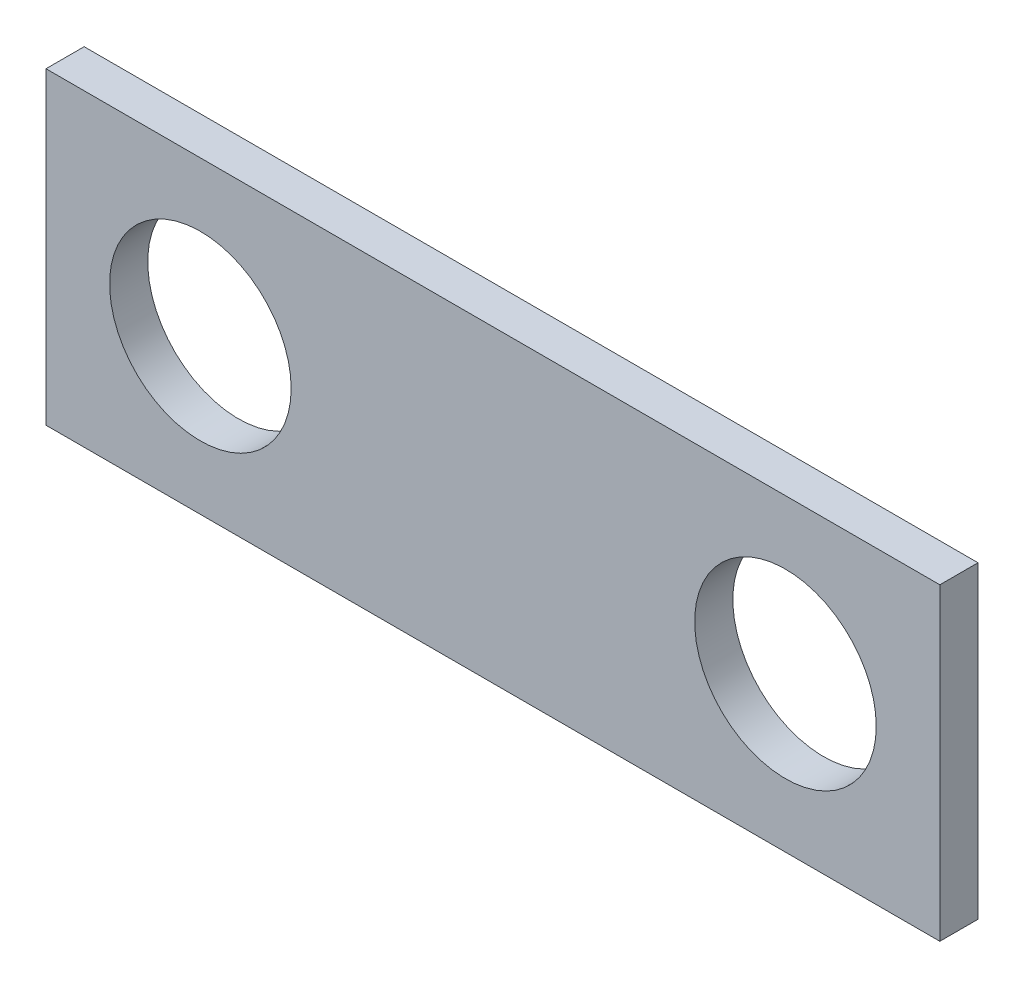
from build123d import *

# Parameters (mm, degrees)
SKETCH1_W           = 140.5496
SKETCH1_H           = 48.5496
SKETCH1_R           = 14.2748
BOSS_EXTRUDE1_DEPTH = 6


with BuildPart() as part:
    # Sketch1 → Boss-Extrude1 (new body)
    with BuildSketch(Plane.XY):
        with Locations((70.2748, 24.2748)):
            Rectangle(SKETCH1_W, SKETCH1_H)
        with Locations((24.2748, 24.2748)):
            Circle(SKETCH1_R, mode=Mode.SUBTRACT)
        with Locations((116.2748, 24.2748)):
            Circle(SKETCH1_R, mode=Mode.SUBTRACT)
    extrude(amount=BOSS_EXTRUDE1_DEPTH)


solid = part.part
